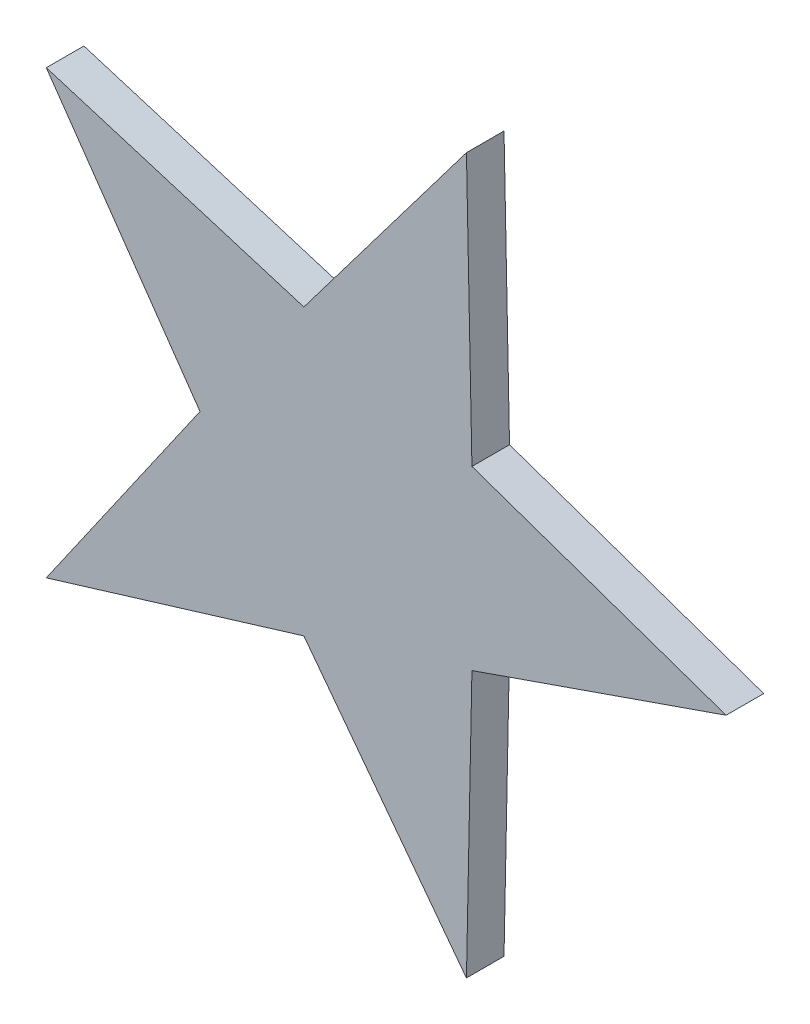
from build123d import *

# Parameters (mm, degrees)
EXTRUDE_1_DEPTH = 50


with BuildPart() as part:
    # 草图1 → 凸台-拉伸1 (new body)
    with BuildSketch(Plane.XY):
        Polygon((500, 0), (161.8, 117.6), (154.5, 475.5), (-61.8, 189.5), (-404.5, 293.9), (-200, 0), (-404.5, -293.9), (-61.8, -189.5), (154.5, -475.5), (161.8, -117.6), align=None)
    extrude(amount=EXTRUDE_1_DEPTH)


solid = part.part
